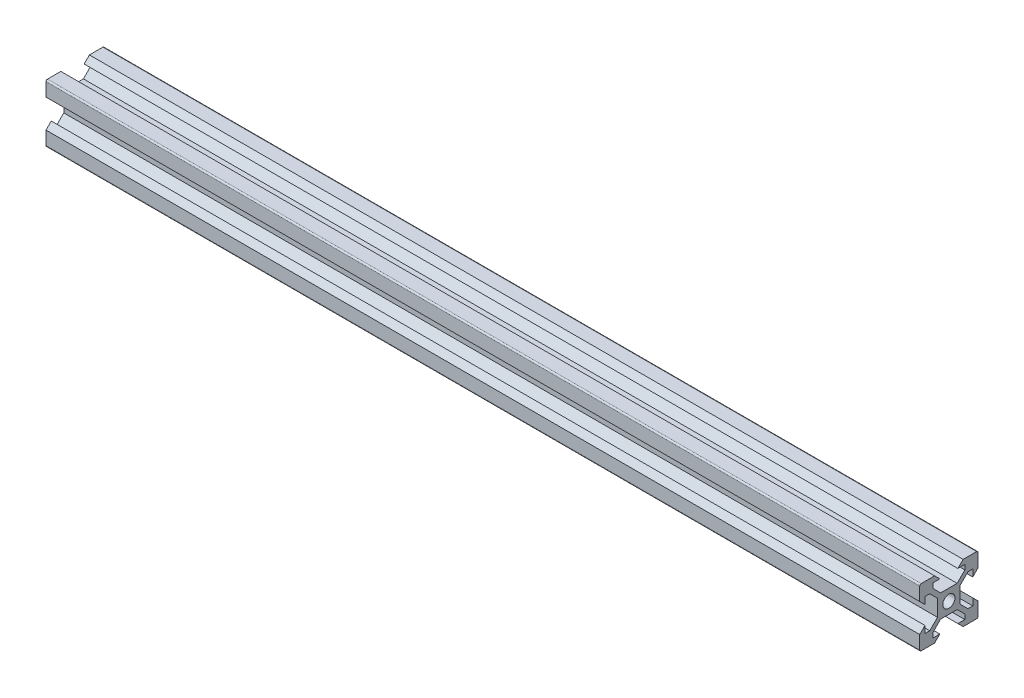
from build123d import *

# Parameters (mm, degrees)
CROQUIS1_W              = 7.801320344
CROQUIS1_H              = 7.801320344
CROQUIS1_R              = 2.1
SALIENTE_EXTRUIR1_DEPTH = 300
REDONDEO1_R             = 0.5


with BuildPart() as part:
    # Croquis1 → Saliente-Extruir1 (new body)
    # profile 1 of 5: a face of its own
    with BuildSketch(Plane(origin=(0, 0, 0), x_dir=(0, 0, -1), z_dir=(1, 0, 0))):
        Polygon((-6.56, 5.499339828), (-3.900660172, 2.84), (-3.900660172, 3.900660172), (-2.84, 3.900660172), (-5.499339828, 6.56), (-5.499339828, 8.2), (-3.1, 8.2), (-4.9, 10), (-10, 10), (-10, 4.9), (-8.2, 3.1), (-8.2, 5.499339828), align=None)
    # profile 2 of 5: a face of its own
    with BuildSketch(Plane(origin=(0, 0, 0), x_dir=(0, 0, -1), z_dir=(1, 0, 0))):
        Rectangle(CROQUIS1_W, CROQUIS1_H)
        Circle(CROQUIS1_R, mode=Mode.SUBTRACT)
    # profile 3 of 5: a face of its own
    with BuildSketch(Plane(origin=(0, 0, 0), x_dir=(0, 0, -1), z_dir=(1, 0, 0))):
        Polygon((5.499339828, 6.56), (2.84, 3.900660172), (3.900660172, 3.900660172), (3.900660172, 2.84), (6.56, 5.499339828), (8.2, 5.499339828), (8.2, 3.1), (10, 4.9), (10, 10), (4.9, 10), (3.1, 8.2), (5.499339828, 8.2), align=None)
    # profile 4 of 5: a face of its own
    with BuildSketch(Plane(origin=(0, 0, 0), x_dir=(0, 0, -1), z_dir=(1, 0, 0))):
        Polygon((3.900660172, -3.900660172), (2.84, -3.900660172), (5.499339828, -6.56), (5.499339828, -8.2), (3.1, -8.2), (4.9, -10), (10, -10), (10, -4.9), (8.2, -3.1), (8.2, -5.499339828), (6.56, -5.499339828), (3.900660172, -2.84), align=None)
    # profile 5 of 5: a face of its own
    with BuildSketch(Plane(origin=(0, 0, 0), x_dir=(0, 0, -1), z_dir=(1, 0, 0))):
        Polygon((-3.900660172, -3.900660172), (-3.900660172, -2.84), (-6.56, -5.499339828), (-8.2, -5.499339828), (-8.2, -3.1), (-10, -4.9), (-10, -10), (-4.9, -10), (-3.1, -8.2), (-5.499339828, -8.2), (-5.499339828, -6.56), (-2.84, -3.900660172), align=None)
    extrude(amount=SALIENTE_EXTRUIR1_DEPTH)

    # Redondeo1
    redondeo1_edges = [part.edges().sort_by_distance(p)[0] for p in [
        (150, -10, -10),
        (150, -10, 10),
        (150, 10, 10),
        (150, 10, -10),
    ]]
    fillet(redondeo1_edges, radius=REDONDEO1_R)


solid = part.part
